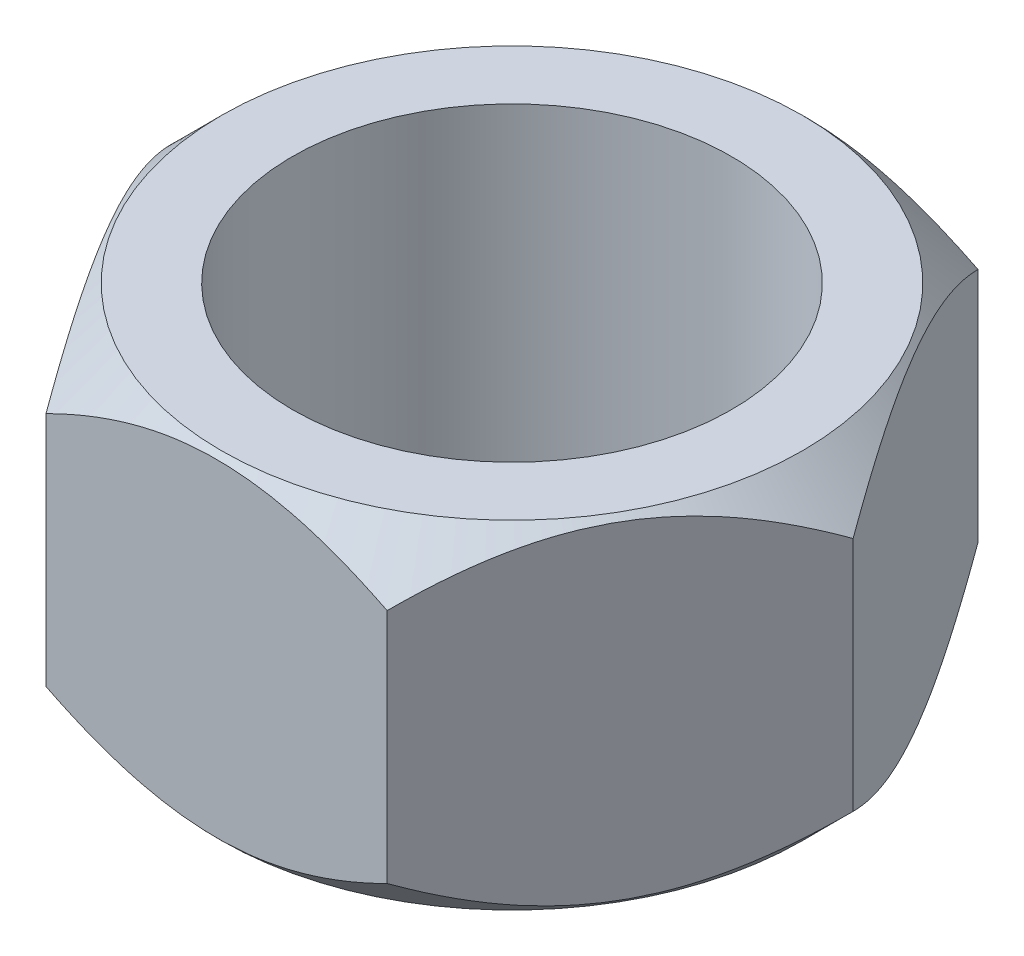
from build123d import *

# Parameters (mm, degrees)
BOSS_EXTRUDE1_DEPTH = 2.54
HOLE1_D             = 6.604


with BuildPart() as part:
    # Sketch2 → Boss-Extrude1 (new, symmetric)
    with BuildSketch(Plane(origin=(0, 0, 0), x_dir=(1, 0, 0), z_dir=(0, 1, 0))):
        Polygon((5.132643893, 0), (2.566321947, 4.445), (-2.566321947, 4.445), (-5.132643893, 0), (-2.566321947, -4.445), (2.566321947, -4.445), align=None)
    extrude(amount=BOSS_EXTRUDE1_DEPTH, both=True)

    # Sketch3 → Cut-Revolve1 (revolve, cut)
    with BuildSketch(Plane.XY, mode=Mode.PRIVATE) as cut_revolve1_sk:
        Polygon((4.370643893, 2.54), (5.132643893, 2.54), (5.132643893, 1.778), align=None)
    cut_revolve1 = revolve(cut_revolve1_sk.sketch.rotate(Axis((0, 0, 0), (0, 1, 0)), 90), axis=Axis((0, 0, 0), (0, 1, 0)), mode=Mode.SUBTRACT)

    # Hole1 (through all)
    with Locations(Plane(origin=(0, 2.54, 0), x_dir=(1, 0, 0), z_dir=(0, 1, 0))):
        with Locations((0, 0)):
            Hole(HOLE1_D / 2)

    # Mirror1: Cut-Revolve1 across plane
    add(cut_revolve1.mirror(Plane.ZX), mode=Mode.SUBTRACT)


solid = part.part
